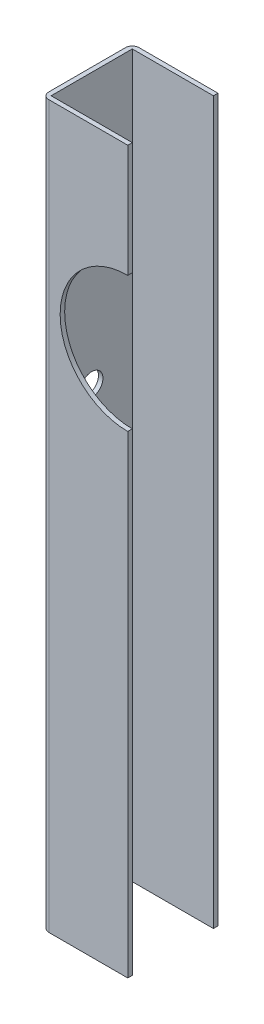
from build123d import *

# Parameters (mm, degrees)
SKETCH1_W               = 25.4
SKETCH1_H               = 25.4
SKETCH1_W_2             = 22.86
SKETCH1_H_2             = 22.86
BOSS_EXTRUDE1_DEPTH     = 203.2
SKETCH2_W               = 25.4
SKETCH2_H               = 203.2
CUT_EXTRUDE1_DEPTH      = 1.27
SKETCH3_R               = 3.175
CUT_EXTRUDE2_DEPTH      = 1.27
CUT_EXTRUDE3_DEPTH      = 206.174779152
CUT_EXTRUDE3_DEPTH_BACK = 2.54
FILLET10_R              = 1.905


with BuildPart() as part:
    # Sketch1 → Boss-Extrude1 (new body)
    with BuildSketch(Plane(origin=(0, 0, 0), x_dir=(1, 0, 0), z_dir=(0, 1, 0))):
        Rectangle(SKETCH1_W, SKETCH1_H)
        Rectangle(SKETCH1_W_2, SKETCH1_H_2, mode=Mode.SUBTRACT)
    extrude(amount=BOSS_EXTRUDE1_DEPTH)

    # Sketch2 → Cut-Extrude1 (cut)
    with BuildSketch(Plane(origin=(12.7, 0, 0), x_dir=(0, 0, -1), z_dir=(1, 0, 0))):
        with Locations((0, 101.6)):
            Rectangle(SKETCH2_W, SKETCH2_H)
    extrude(amount=-CUT_EXTRUDE1_DEPTH, mode=Mode.SUBTRACT)

    # Sketch3 → Cut-Extrude2 (cut)
    with BuildSketch(Plane.ZY.offset(12.7)):
        with Locations((0, 25.4)):
            Circle(SKETCH3_R)
        with Locations((0, 76.2)):
            Circle(SKETCH3_R)
        with Locations((0, 127)):
            Circle(SKETCH3_R)
        with Locations((0, 177.8)):
            Circle(SKETCH3_R)
    extrude(amount=-CUT_EXTRUDE2_DEPTH, mode=Mode.SUBTRACT)

    # Sketch4 → Cut-Extrude3 (cut, two sides: drawn at the far end of the back side and taken through both)
    with BuildSketch(Plane.XY.offset(12.7).offset(-CUT_EXTRUDE3_DEPTH_BACK)):
        with BuildLine():
            Line((367.709421277, 171.45), (11.43, 171.45))
            ThreePointArc((11.43, 171.45), (-7.62, 152.4), (11.43, 133.35))
            Line((11.43, 133.35), (367.709421277, 133.35))
            Line((367.709421277, 133.35), (1080.268263831, 133.35))
            Line((1080.268263831, 133.35), (1080.268263831, 171.45))
            Line((1080.268263831, 171.45), (367.709421277, 171.45))
        make_face()
    extrude(amount=CUT_EXTRUDE3_DEPTH + CUT_EXTRUDE3_DEPTH_BACK, mode=Mode.SUBTRACT)

    # Fillet10
    fillet10_edges = [part.edges().sort_by_distance(p)[0] for p in [
        (-12.7, 101.6, 12.7),
        (-12.7, 101.6, -12.7),
    ]]
    fillet(fillet10_edges, radius=FILLET10_R)


solid = part.part
